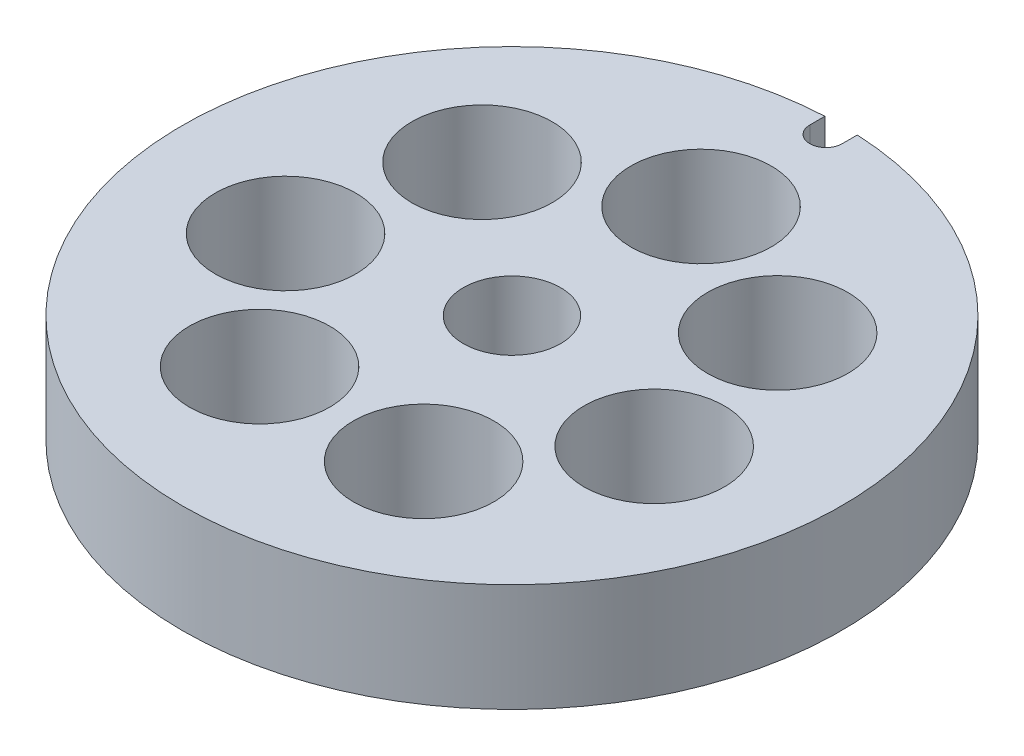
from build123d import *

# Parameters (mm, degrees)
SZKIC1_R                    = 4.5
SZKIC1_R_2                  = 6.5
DODANIE_WYCI_GNI_CIE1_DEPTH = 10


with BuildPart() as part:
    # Szkic1 → Dodanie-wyciągnięcie1 (new body)
    with BuildSketch(Plane(origin=(0, 0, 0), x_dir=(1, 0, 0), z_dir=(0, 1, 0))):
        with BuildLine():
            Line((-1.5, 30.463092423), (-1.5, 29.063092423))
            ThreePointArc((-1.5, 29.063092423), (0, 27.563092423), (1.5, 29.063092423))
            Line((1.5, 29.063092423), (1.5, 30.463092423))
            ThreePointArc((1.5, 30.463092423), (0, -30.5), (-1.5, 30.463092423))
        make_face()
        with Locations(Location((0, 0, 0), (0, 0, 270))):
            Circle(SZKIC1_R, mode=Mode.SUBTRACT)
        with Locations(Location((0, 17.5, 0), (0, 0, 270))):
            Circle(SZKIC1_R_2, mode=Mode.SUBTRACT)
        with Locations(Location((13.682050943, 10.911071533, 0), (0, 0, 270))):
            Circle(SZKIC1_R_2, mode=Mode.SUBTRACT)
        with Locations(Location((17.061238463, -3.894116344, 0), (0, 0, 270))):
            Circle(SZKIC1_R_2, mode=Mode.SUBTRACT)
        with Locations(Location((7.592965435, -15.766955188, 0), (0, 0, 270))):
            Circle(SZKIC1_R_2, mode=Mode.SUBTRACT)
        with Locations(Location((-7.592965435, -15.766955188, 0), (0, 0, 270))):
            Circle(SZKIC1_R_2, mode=Mode.SUBTRACT)
        with Locations(Location((-17.061238463, -3.894116344, 0), (0, 0, 270))):
            Circle(SZKIC1_R_2, mode=Mode.SUBTRACT)
        with Locations(Location((-13.682050943, 10.911071533, 0), (0, 0, 270))):
            Circle(SZKIC1_R_2, mode=Mode.SUBTRACT)
    extrude(amount=DODANIE_WYCI_GNI_CIE1_DEPTH)


solid = part.part
